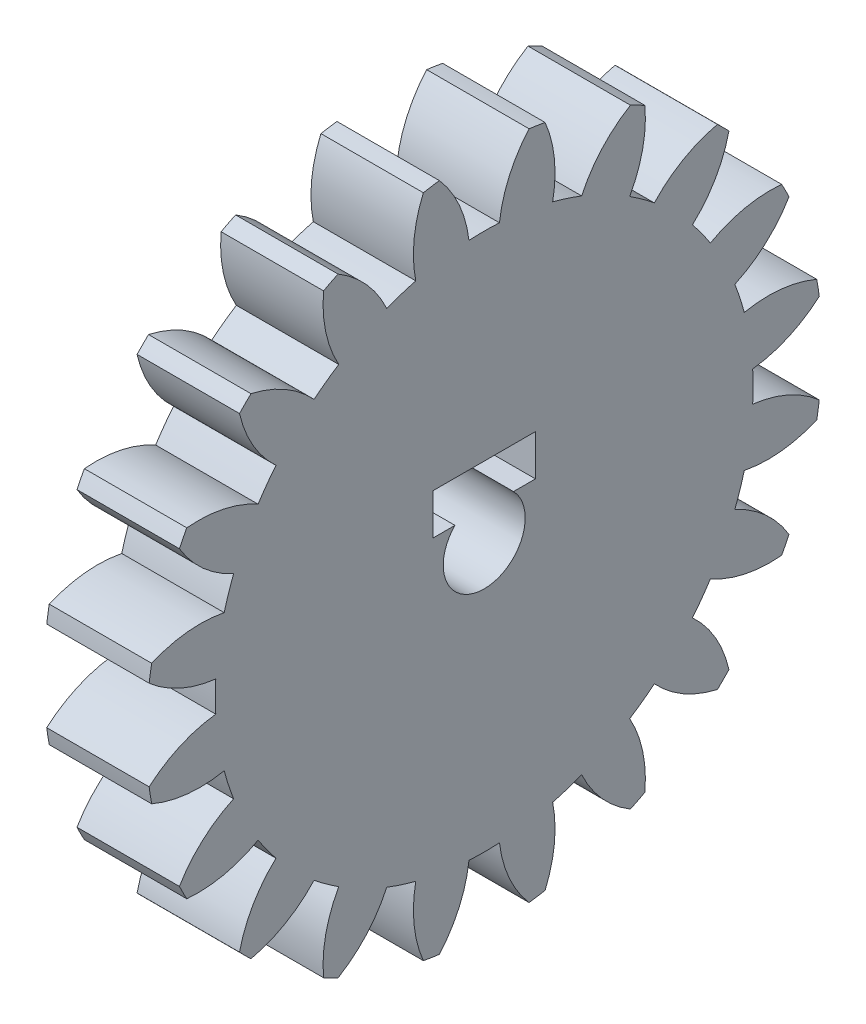
from build123d import *

# Parameters (mm, degrees)
BASPROSKE_W        = 5
BASPROSKE_H        = 16.5
TOOTHCUT_DEPTH     = 24.864199128
TEETHCUTS_COUNT    = 20
TEETHCUTS_ANGLE    = 342
BORSKE_R           = 2
BORE_DEPTH         = 50.0000508
CUT_EXTRUDE1_DEPTH = 10


with BuildPart() as part:
    # BasProSke → Base-Revolve (revolve)
    with BuildSketch(Plane(origin=(0, 0, 0), x_dir=(1, 0, 0), z_dir=(0, 1, 0)), mode=Mode.PRIVATE) as base_revolve_sk:
        with Locations((2.5, 8.25)):
            Rectangle(BASPROSKE_W, BASPROSKE_H)
    revolve(base_revolve_sk.sketch.rotate(Axis((-10, 0, 0), (1, 0, 0)), 180), axis=Axis((-10, 0, 0), (1, 0, 0)))

    # TooCutSke → ToothCut (cut, through all)
    with BuildSketch(Plane(origin=(0, 0, 0), x_dir=(0, 0, -1), z_dir=(1, 0, 0))):
        with BuildLine():
            ThreePointArc((0.74381438, 13.102904875), (0, 13.124), (-0.74381438, 13.102904875))
            ThreePointArc((-0.74381438, 13.102904875), (-1.226473103, 14.852072512), (-2.209965745, 16.376962373))
            ThreePointArc((-2.209965745, 16.376962373), (0, 16.5254), (2.209965745, 16.376962373))
            ThreePointArc((2.209965745, 16.376962373), (1.226473103, 14.852072512), (0.74381438, 13.102904875))
        make_face()
    toothcut = extrude(amount=TOOTHCUT_DEPTH, mode=Mode.SUBTRACT)

    # TeethCuts: ToothCut ×20 about axis
    teethcuts_axis = Axis((-10, 0, 0), (1, 0, 0))
    for i in range(1, TEETHCUTS_COUNT):
        add(toothcut.rotate(teethcuts_axis, i * TEETHCUTS_ANGLE / (TEETHCUTS_COUNT - 1)), mode=Mode.SUBTRACT)

    # BorSke → Bore (cut, symmetric)
    with BuildSketch(Plane(origin=(0, 0, 0), x_dir=(0, 0, -1), z_dir=(1, 0, 0))):
        with Locations(Location((0, 0, 0), (0, 0, 180))):
            Circle(BORSKE_R)
    extrude(amount=BORE_DEPTH, both=True, mode=Mode.SUBTRACT)

    # Sketch1 → Cut-Extrude1 (cut)
    with BuildSketch(Plane(origin=(5, 0, 0), x_dir=(0, 0, -1), z_dir=(1, 0, 0))):
        with BuildLine():
            Line((-1.428285686, 1.4), (-2.5, 1.4))
            Line((-2.5, 1.4), (-2.5, 3.4))
            Line((-2.5, 3.4), (2.5, 3.4))
            Line((2.5, 3.4), (2.5, 1.4))
            Line((2.5, 1.4), (1.428285686, 1.4))
            ThreePointArc((1.428285686, 1.4), (0, 2), (-1.428285686, 1.4))
        make_face()
    extrude(amount=-CUT_EXTRUDE1_DEPTH, mode=Mode.SUBTRACT)


solid = part.part
